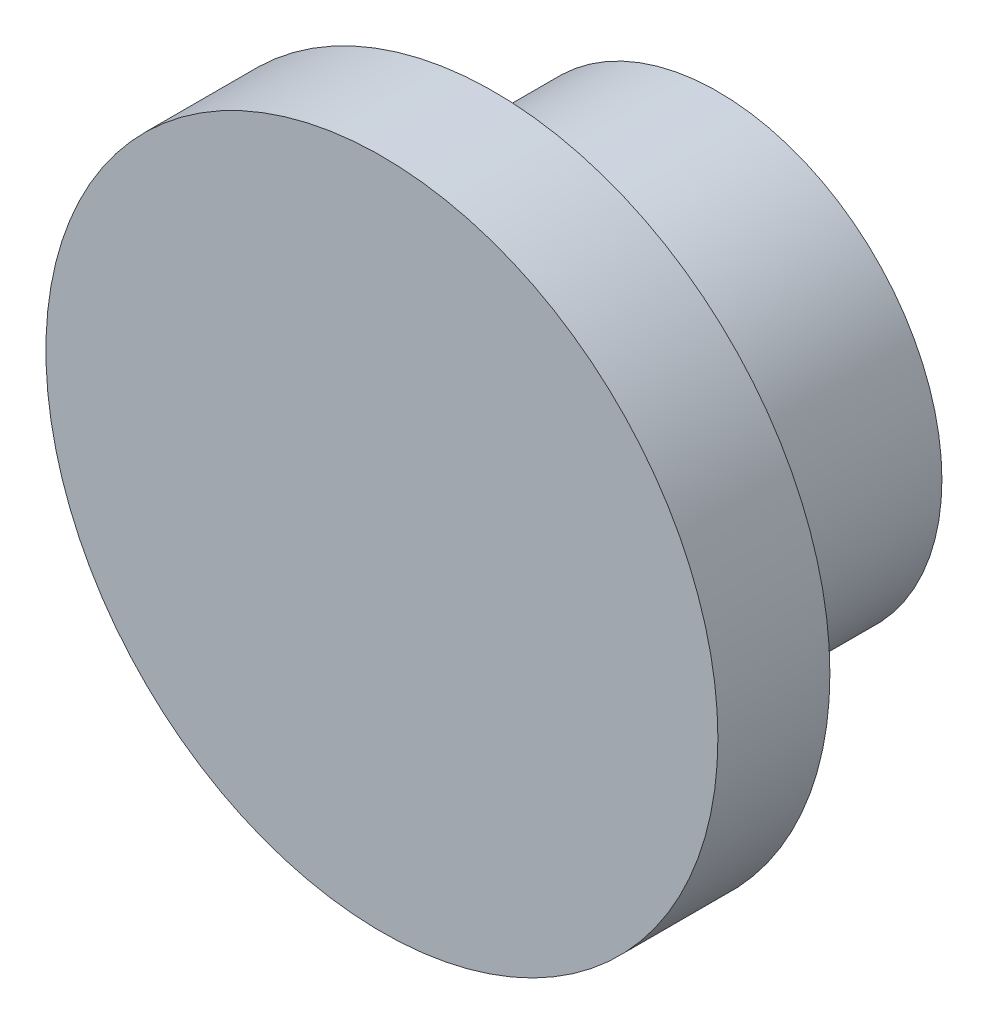
from build123d import *

# Parameters (mm, degrees)
SKETCH_1_R      = 2
EXTRUDE_1_DEPTH = 2
SKETCH_2_R      = 3
EXTRUDE_2_DEPTH = 1


with BuildPart() as part:
    # 草图1 → 凸台-拉伸1 (new body)
    with BuildSketch(Plane.XY):
        Circle(SKETCH_1_R)
    extrude(amount=EXTRUDE_1_DEPTH)

    # 草图2 → 凸台-拉伸2 (add)
    with BuildSketch(Plane.XY.offset(2)):
        Circle(SKETCH_2_R)
    extrude(amount=EXTRUDE_2_DEPTH)


solid = part.part
